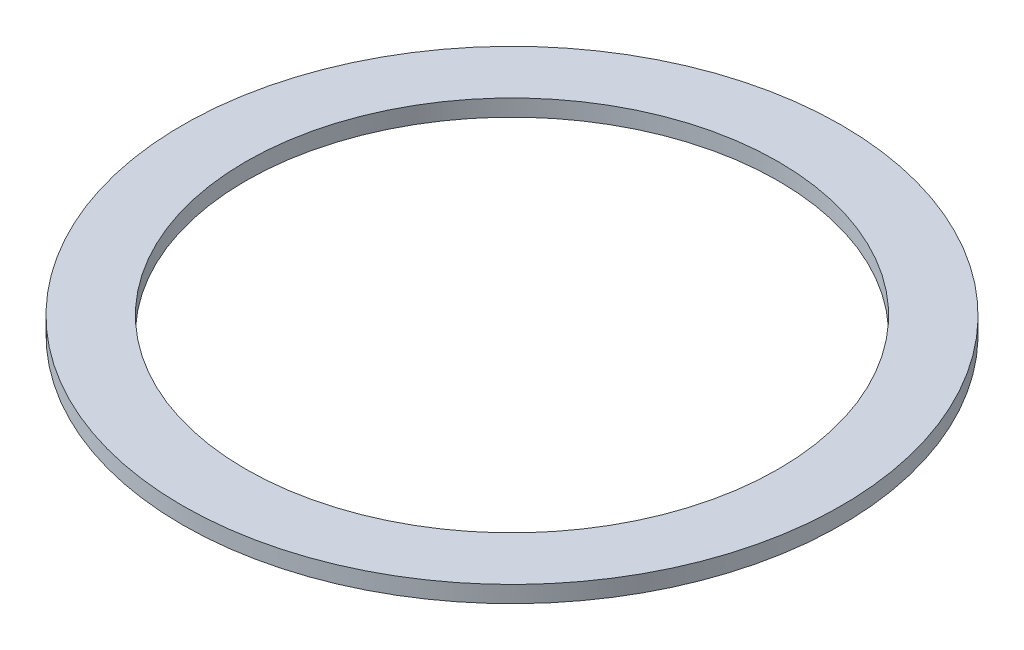
from build123d import *

# Parameters (mm, degrees)
SKETCH1_R           = 62.865
SKETCH1_R_2         = 50.8
BOSS_EXTRUDE1_DEPTH = 3.175


with BuildPart() as part:
    # Sketch1 → Boss-Extrude1 (new body)
    with BuildSketch(Plane(origin=(0, 0, 0), x_dir=(1, 0, 0), z_dir=(0, 1, 0))):
        with Locations(Location((0, 0, 0), (0, 0, 270))):
            Circle(SKETCH1_R)
        with Locations(Location((0, 0, 0), (0, 0, 270))):
            Circle(SKETCH1_R_2, mode=Mode.SUBTRACT)
    extrude(amount=BOSS_EXTRUDE1_DEPTH)


solid = part.part
